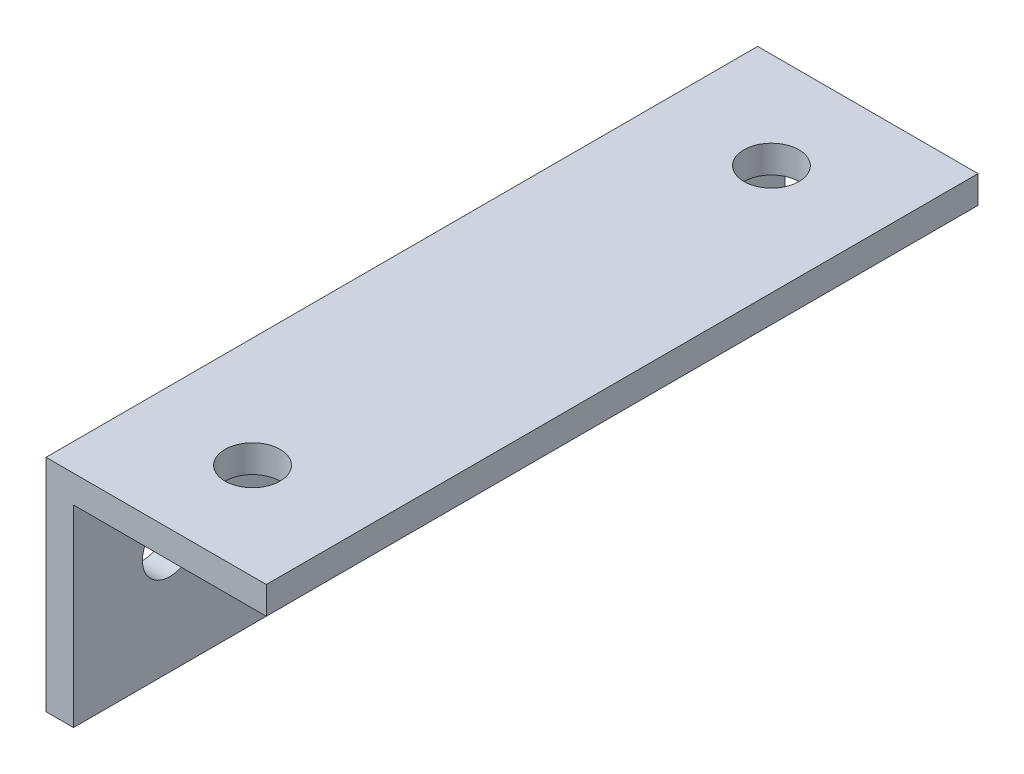
from build123d import *

# Parameters (mm, degrees)
BOSS_EXTRUDE1_DEPTH = 82.042
SKETCH2_R           = 3.175
CUT_EXTRUDE2_DEPTH  = 82.042
SKETCH3_R           = 3.175
CUT_EXTRUDE3_DEPTH  = 82.042


with BuildPart() as part:
    # Sketch1 → Boss-Extrude1 (new body)
    with BuildSketch(Plane.XY):
        Polygon((0, 0), (0, 25.4), (25.4, 25.4), (25.4, 22.225), (3.175, 22.225), (3.175, 0), align=None)
    extrude(amount=BOSS_EXTRUDE1_DEPTH)

    # Sketch2 → Cut-Extrude2 (cut)
    with BuildSketch(Plane.ZY):
        with Locations((70.9295, 12.7)):
            Circle(SKETCH2_R)
        with Locations((11.1125, 12.7)):
            Circle(SKETCH2_R)
    extrude(amount=-CUT_EXTRUDE2_DEPTH, mode=Mode.SUBTRACT)

    # Sketch3 → Cut-Extrude3 (cut)
    with BuildSketch(Plane(origin=(0, 25.4, 0), x_dir=(1, 0, 0), z_dir=(0, 1, 0))):
        with Locations(Location((12.7, -11.1125, 0), (0, 0, 270))):
            Circle(SKETCH3_R)
        with Locations(Location((12.7, -70.9295, 0), (0, 0, 270))):
            Circle(SKETCH3_R)
    extrude(amount=-CUT_EXTRUDE3_DEPTH, mode=Mode.SUBTRACT)


solid = part.part
